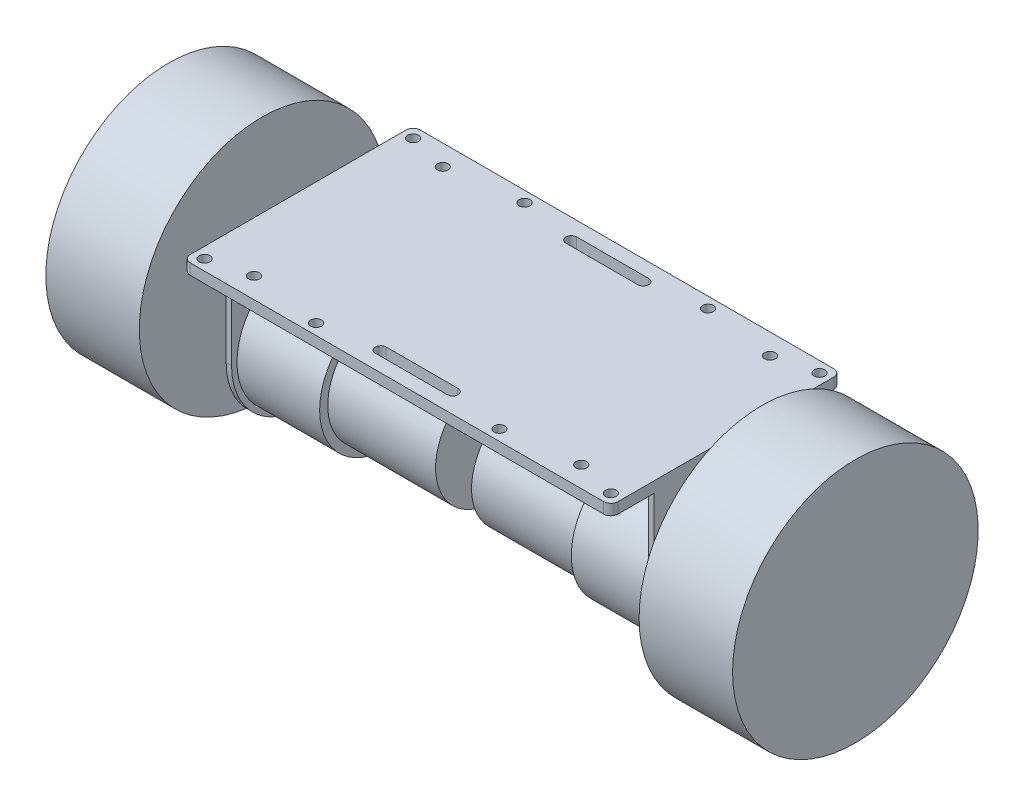
from build123d import *

# Parameters (mm, degrees)
SKETCH2_R           = 1.5
BOSS_EXTRUDE1_DEPTH = 3
SKETCH4_W           = 1.5
SKETCH4_H           = 40
BOSS_EXTRUDE2_DEPTH = 48
CUT_EXTRUDE1_DEPTH  = 133.245982926
SKETCH6_R           = 18.5
BOSS_EXTRUDE3_DEPTH = 23
SKETCH7_R           = 16.25
BOSS_EXTRUDE4_DEPTH = 30
SKETCH8_R           = 6
BOSS_EXTRUDE5_DEPTH = 10
SKETCH9_R           = 34.15
BOSS_EXTRUDE6_DEPTH = 26


with BuildPart() as part:
    # Sketch2 → Boss-Extrude1 (new body)
    with BuildSketch(Plane(origin=(0, 0, 0), x_dir=(1, 0, 0), z_dir=(0, 1, 0))):
        with BuildLine():
            Line((57.5, -32), (-57.5, -32))
            ThreePointArc((-57.5, -32), (-58.914213562, -31.414213562), (-59.5, -30))
            Line((-59.5, -30), (-59.5, 30))
            ThreePointArc((-59.5, 30), (-58.914213562, 31.414213562), (-57.5, 32))
            Line((-57.5, 32), (57.5, 32))
            ThreePointArc((57.5, 32), (58.914213562, 31.414213562), (59.5, 30))
            Line((59.5, 30), (59.5, -30))
            ThreePointArc((59.5, -30), (58.914213562, -31.414213562), (57.5, -32))
        make_face()
        with Locations(Location((-56.5, 29, 0), (0, 0, 270))):
            Circle(SKETCH2_R, mode=Mode.SUBTRACT)
        with Locations(Location((-45.5, 26.25, 0), (0, 0, 270))):
            Circle(SKETCH2_R, mode=Mode.SUBTRACT)
        with Locations(Location((-25.5, 29, 0), (0, 0, 270))):
            Circle(SKETCH2_R, mode=Mode.SUBTRACT)
        with Locations(Location((-25.5, -29, 0), (0, 0, 90))):
            Circle(SKETCH2_R, mode=Mode.SUBTRACT)
        with Locations(Location((-45.5, -26.25, 0), (0, 0, 90))):
            Circle(SKETCH2_R, mode=Mode.SUBTRACT)
        with Locations(Location((-56.5, -29, 0), (0, 0, 90))):
            Circle(SKETCH2_R, mode=Mode.SUBTRACT)
        with Locations(Location((25.5, -29, 0), (0, 0, 270))):
            Circle(SKETCH2_R, mode=Mode.SUBTRACT)
        with Locations(Location((45.5, -26.25, 0), (0, 0, 270))):
            Circle(SKETCH2_R, mode=Mode.SUBTRACT)
        with Locations(Location((56.5, -29, 0), (0, 0, 270))):
            Circle(SKETCH2_R, mode=Mode.SUBTRACT)
        with Locations(Location((56.5, 29, 0), (0, 0, 90))):
            Circle(SKETCH2_R, mode=Mode.SUBTRACT)
        with Locations(Location((45.5, 26.25, 0), (0, 0, 90))):
            Circle(SKETCH2_R, mode=Mode.SUBTRACT)
        with Locations(Location((25.5, 29, 0), (0, 0, 90))):
            Circle(SKETCH2_R, mode=Mode.SUBTRACT)
        with BuildLine():
            Line((10, 28), (-10, 28))
            ThreePointArc((-10, 28), (-11.5, 26.5), (-10, 25))
            Line((-10, 25), (10, 25))
            ThreePointArc((10, 25), (11.5, 26.5), (10, 28))
        make_face(mode=Mode.SUBTRACT)
        with BuildLine():
            Line((-10, -25), (10, -25))
            ThreePointArc((10, -25), (11.5, -26.5), (10, -28))
            Line((10, -28), (-10, -28))
            ThreePointArc((-10, -28), (-11.5, -26.5), (-10, -25))
        make_face(mode=Mode.SUBTRACT)
    extrude(amount=BOSS_EXTRUDE1_DEPTH)

    # Sketch4 → Boss-Extrude2 (add)
    with BuildSketch(Plane.XZ):
        with Locations((-58.75, 0)):
            Rectangle(SKETCH4_W, SKETCH4_H)
    boss_extrude2 = extrude(amount=BOSS_EXTRUDE2_DEPTH)

    # Mirror3: Boss-Extrude2 across plane
    add(boss_extrude2.mirror(Plane(origin=(0, 0, 0), x_dir=(0, 0, 1), z_dir=(1, 0, 0))))

    # Sketch5 → Cut-Extrude1 (cut, through all)
    with BuildSketch(Plane.ZY.offset(59.5)):
        with BuildLine():
            ThreePointArc((-1.66e-07, -48), (-14.142135683, -42.142135565), (-20, -28))
            Line((-20, -28), (-20, -48))
            Line((-20, -48), (-1.66e-07, -48))
        make_face()
        with BuildLine():
            ThreePointArc((20, -28), (14.142135565, -42.142135683), (-1.66e-07, -48))
            Line((-1.66e-07, -48), (20, -48))
            Line((20, -48), (20, -28))
        make_face()
    extrude(amount=-CUT_EXTRUDE1_DEPTH, mode=Mode.SUBTRACT)

    # Sketch6 → Boss-Extrude3 (add)
    with BuildSketch(Plane(origin=(-58, 0, 0), x_dir=(0, 0, -1), z_dir=(1, 0, 0))):
        with Locations(Location((0, -28, 0), (0, 0, 180))):
            Circle(SKETCH6_R)
    boss_extrude3 = extrude(amount=BOSS_EXTRUDE3_DEPTH)

    # Sketch7 → Boss-Extrude4 (add)
    with BuildSketch(Plane(origin=(-35, 0, 0), x_dir=(0, 0, -1), z_dir=(1, 0, 0))):
        with Locations((0, -28)):
            Circle(SKETCH7_R)
    boss_extrude4 = extrude(amount=BOSS_EXTRUDE4_DEPTH)

    # Sketch8 → Boss-Extrude5 (add)
    with BuildSketch(Plane.ZY.offset(59.5)):
        with Locations(Location((0, -18, 0), (0, 0, 180))):
            Circle(SKETCH8_R)
    boss_extrude5 = extrude(amount=BOSS_EXTRUDE5_DEPTH)

    # Sketch9 → Boss-Extrude6 (add)
    with BuildSketch(Plane.ZY.offset(69.5)):
        with Locations(Location((0, -18, 0), (0, 0, 180))):
            Circle(SKETCH9_R)
    boss_extrude6 = extrude(amount=BOSS_EXTRUDE6_DEPTH)

    # Mirror7: Boss-Extrude3, Boss-Extrude4, Boss-Extrude5, Boss-Extrude6 across plane
    add(boss_extrude3.mirror(Plane(origin=(0, 0, 0), x_dir=(0, 0, 1), z_dir=(1, 0, 0))))
    add(boss_extrude4.mirror(Plane(origin=(0, 0, 0), x_dir=(0, 0, 1), z_dir=(1, 0, 0))))
    add(boss_extrude5.mirror(Plane(origin=(0, 0, 0), x_dir=(0, 0, 1), z_dir=(1, 0, 0))))
    add(boss_extrude6.mirror(Plane(origin=(0, 0, 0), x_dir=(0, 0, 1), z_dir=(1, 0, 0))))


solid = part.part
